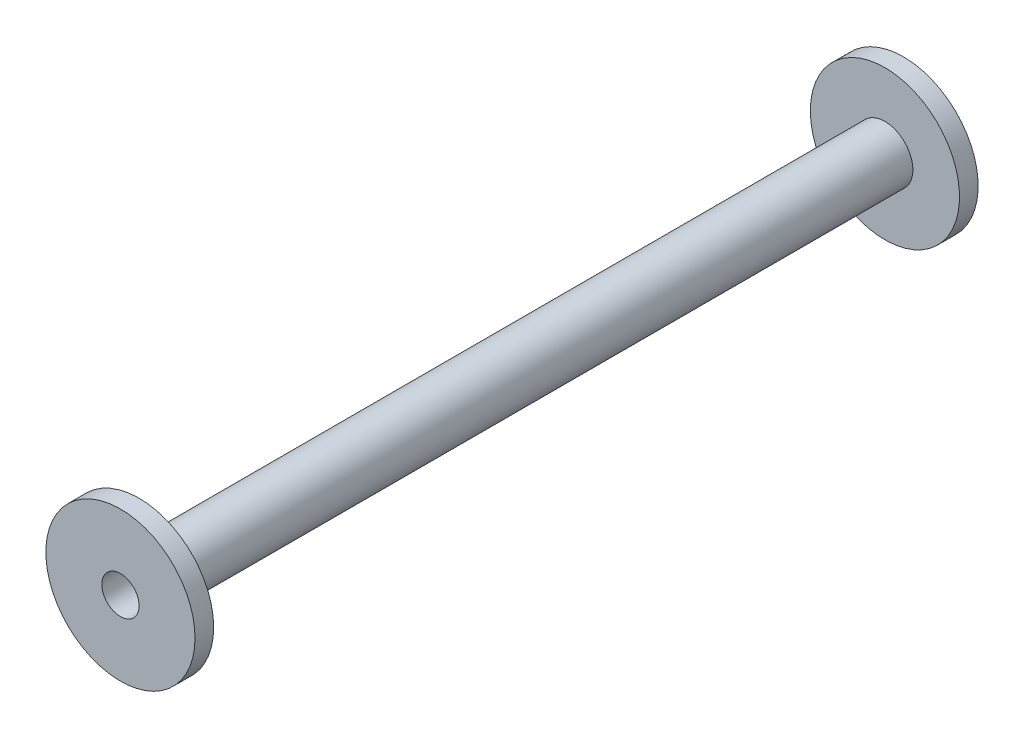
from build123d import *

# Parameters (mm, degrees)
SKETCH1_R           = 19.05
SKETCH1_R_2         = 12.7
BOSS_EXTRUDE1_DEPTH = 266.7
BOSS_EXTRUDE2_START = -12.7
SKETCH2_R           = 50.8
SKETCH2_R_2         = 12.7
BOSS_EXTRUDE2_DEPTH = 12.7
SKETCH3_R           = 50.8
SKETCH3_R_2         = 12.7
BOSS_EXTRUDE3_DEPTH = 12.7


with BuildPart() as part:
    # Sketch1 → Boss-Extrude1 (new, symmetric)
    with BuildSketch(Plane.XY):
        Circle(SKETCH1_R)
        Circle(SKETCH1_R_2, mode=Mode.SUBTRACT)
    extrude(amount=BOSS_EXTRUDE1_DEPTH, both=True)

    # Sketch2 → Boss-Extrude2 (add)
    with BuildSketch(Plane.XY.offset(266.7).offset(BOSS_EXTRUDE2_START)):
        Circle(SKETCH2_R)
        Circle(SKETCH2_R_2, mode=Mode.SUBTRACT)
    extrude(amount=BOSS_EXTRUDE2_DEPTH)

    # Sketch3 → Boss-Extrude3 (add)
    with BuildSketch(Plane(origin=(0, 0, -266.7), x_dir=(-1, 0, 0), z_dir=(0, 0, -1))):
        with Locations(Location((0, 0, 0), (0, 0, 180))):
            Circle(SKETCH3_R)
        with Locations(Location((0, 0, 0), (0, 0, 180))):
            Circle(SKETCH3_R_2, mode=Mode.SUBTRACT)
    extrude(amount=-BOSS_EXTRUDE3_DEPTH)


solid = part.part
